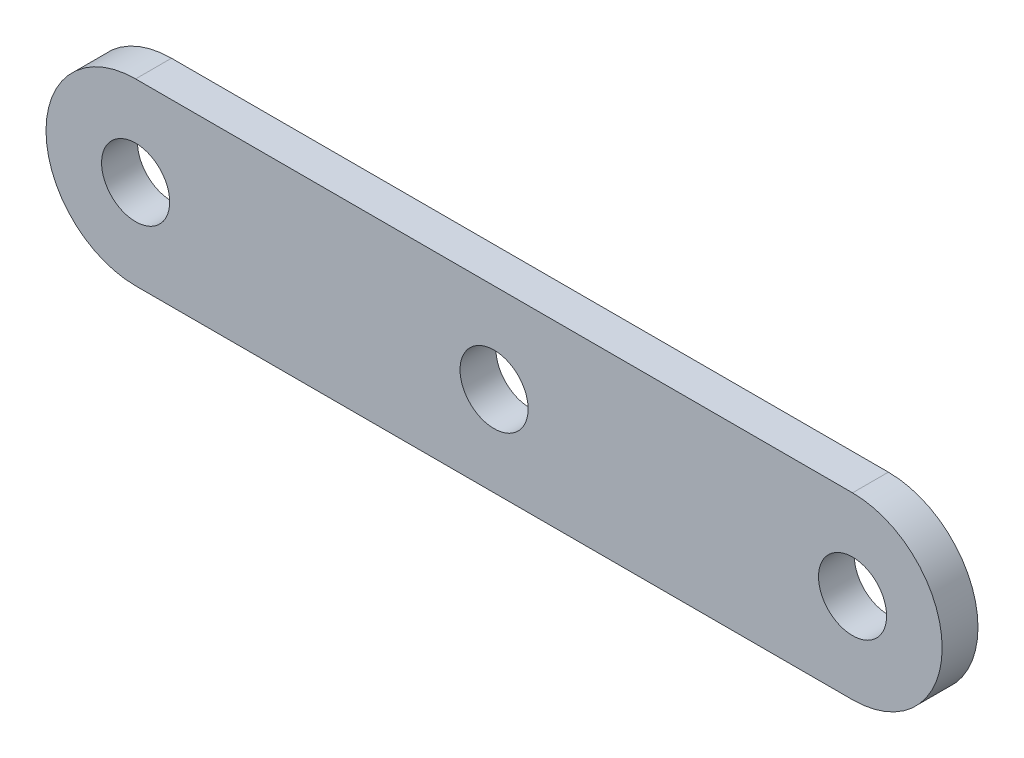
from build123d import *

# Parameters (mm, degrees)
SALIENTE_EXTRUIR1_DEPTH = 1.27
CROQUIS2_R              = 2.413
CORTAR_EXTRUIR1_DEPTH   = 33.478248105
MATRIZL1_COUNT          = 3
MATRIZL1_PITCH          = 25.4


with BuildPart() as part:
    # Croquis1 → Saliente-Extruir1 (new, symmetric)
    with BuildSketch(Plane.XY):
        with BuildLine():
            Line((25.4, -6.35), (-25.4, -6.35))
            ThreePointArc((-25.4, -6.35), (-31.75, 0), (-25.4, 6.35))
            Line((-25.4, 6.35), (25.4, 6.35))
            ThreePointArc((25.4, 6.35), (31.75, 0), (25.4, -6.35))
        make_face()
    extrude(amount=SALIENTE_EXTRUIR1_DEPTH, both=True)

    # Croquis2 → Cortar-Extruir1 (cut, through all)
    with BuildSketch(Plane.XY.offset(1.27)):
        with Locations((-25.4, 0)):
            Circle(CROQUIS2_R)
    cortar_extruir1 = extrude(amount=-CORTAR_EXTRUIR1_DEPTH, mode=Mode.SUBTRACT)

    # MatrizL1: Cortar-Extruir1 ×3
    with Locations(*[(i * MATRIZL1_PITCH, 0, 0) for i in range(1, MATRIZL1_COUNT)]):
        add(cortar_extruir1, mode=Mode.SUBTRACT)


solid = part.part
